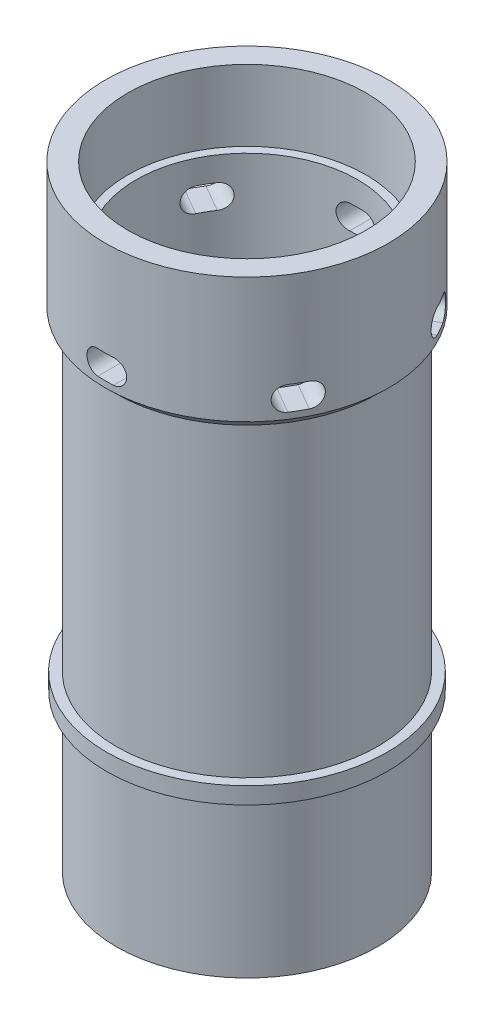
from build123d import *

# Parameters (mm, degrees)
SKETCH1_R           = 17.2085
SKETCH1_R_2         = 14.478
BOSS_EXTRUDE1_DEPTH = 15.24
SKETCH2_R           = 15.875
SKETCH2_R_2         = 13.462
BOSS_EXTRUDE2_DEPTH = 66.1162
SKETCH3_R           = 17.0561
SKETCH3_R_2         = 15.875
BOSS_EXTRUDE3_DEPTH = 2.032
CUT_EXTRUDE1_DEPTH  = 23.876
CIRPATTERN1_COUNT   = 3
CIRPATTERN1_ANGLE   = 120
CHAMFER1_SIZE       = 1.2954


with BuildPart() as part:
    # Sketch1 → Boss-Extrude1 (new body)
    with BuildSketch(Plane(origin=(0, 0, 0), x_dir=(1, 0, 0), z_dir=(0, 1, 0))):
        with Locations(Location((0, 0, 0), (0, 0, 270))):
            Circle(SKETCH1_R)
        with Locations(Location((0, 0, 0), (0, 0, 270))):
            Circle(SKETCH1_R_2, mode=Mode.SUBTRACT)
    extrude(amount=-BOSS_EXTRUDE1_DEPTH)

    # Sketch2 → Boss-Extrude2 (add)
    with BuildSketch(Plane(origin=(0, -8.636, 0), x_dir=(-1, 0, 0), z_dir=(0, 1, 0))):
        with Locations(Location((0, 0, 0), (0, 0, 90))):
            Circle(SKETCH2_R)
        with Locations(Location((0, 0, 0), (0, 0, 90))):
            Circle(SKETCH2_R_2, mode=Mode.SUBTRACT)
    extrude(amount=-BOSS_EXTRUDE2_DEPTH)

    # Sketch5 → Cut-Extrude1 (cut, symmetric)
    with BuildSketch(Plane.XY):
        with BuildLine():
            Line((-0.952496631, -11.563239179), (0.9525, -11.563239179))
            ThreePointArc((0.9525, -11.563239179), (2.413, -13.023739179), (0.9525, -14.484239179))
            Line((0.9525, -14.484239179), (-0.9525, -14.484239179))
            ThreePointArc((-0.9525, -14.484239179), (-2.412996631, -13.023737494), (-0.952496631, -11.563239179))
        make_face()
    cut_extrude1 = extrude(amount=CUT_EXTRUDE1_DEPTH, both=True, mode=Mode.SUBTRACT)

    # CirPattern1: Cut-Extrude1 ×3 about axis
    cirpattern1_axis = Axis((0, -15.24, 0), (0, 1, 0))
    for i in range(1, CIRPATTERN1_COUNT):
        add(cut_extrude1.rotate(cirpattern1_axis, i * CIRPATTERN1_ANGLE / (CIRPATTERN1_COUNT - 1)), mode=Mode.SUBTRACT)

    # Chamfer1
    chamfer1_edges = [part.edges().sort_by_distance(p)[0] for p in [
        (0, -15.24, -15.875),
    ]]
    chamfer(chamfer1_edges, length=CHAMFER1_SIZE)


with BuildPart() as body_2:
    # Sketch3 → Boss-Extrude3 (new body)
    with BuildSketch(Plane(origin=(0, -53.6702, 0), x_dir=(-1, 0, 0), z_dir=(0, 1, 0))):
        with Locations(Location((0, 0, 0), (0, 0, 90))):
            Circle(SKETCH3_R)
        with Locations(Location((0, 0, 0), (0, 0, 90))):
            Circle(SKETCH3_R_2, mode=Mode.SUBTRACT)
    extrude(amount=-BOSS_EXTRUDE3_DEPTH)


solid = Compound([part.part, body_2.part])
